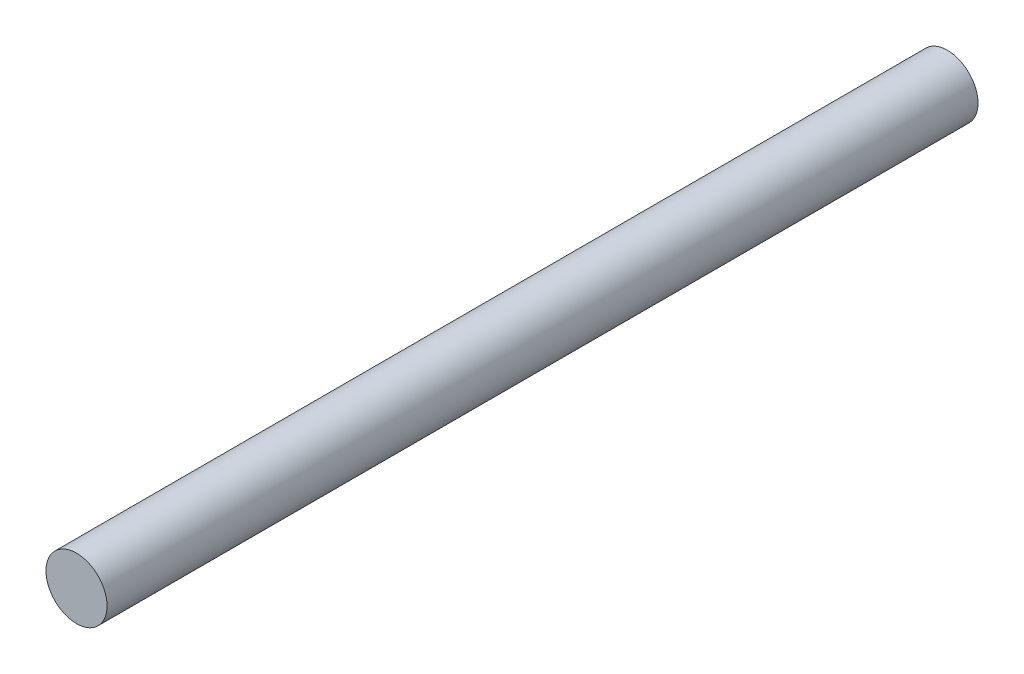
from build123d import *

# Parameters (mm, degrees)
SKETCH1_R           = 3
BOSS_EXTRUDE1_DEPTH = 85.5


with BuildPart() as part:
    # Sketch1 → Boss-Extrude1 (new body)
    with BuildSketch(Plane.XY):
        Circle(SKETCH1_R)
    extrude(amount=BOSS_EXTRUDE1_DEPTH)


solid = part.part
